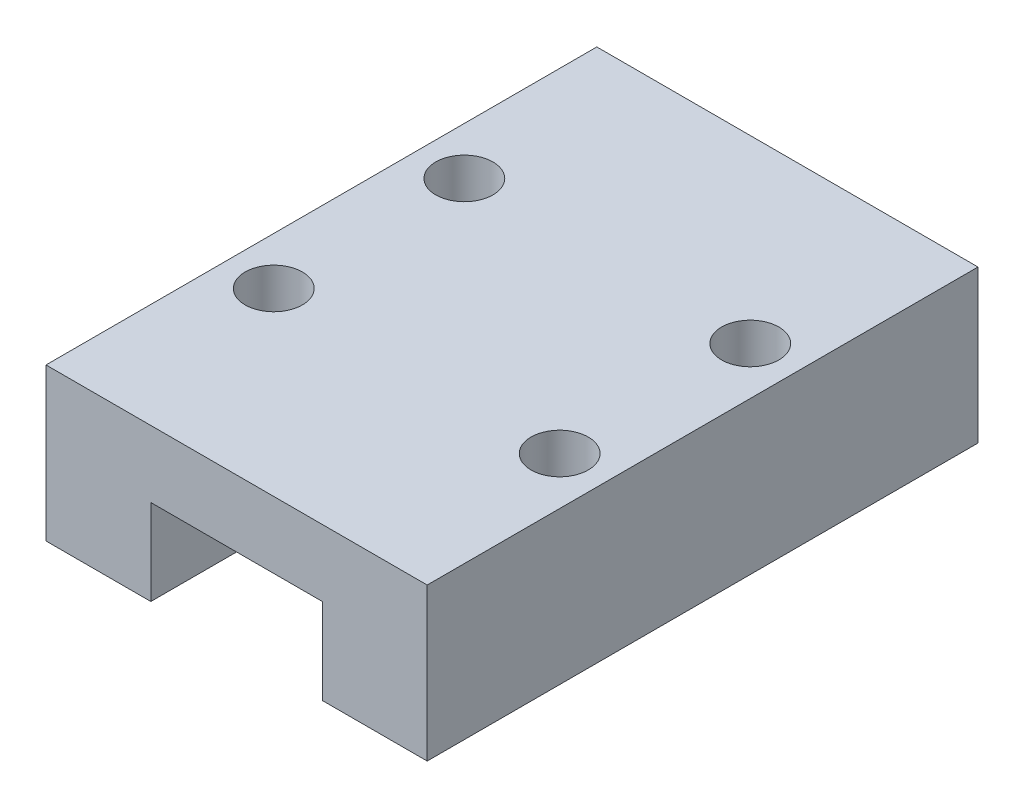
from build123d import *

# Parameters (mm, degrees)
EXTRUDE_1_DEPTH     = 28.9
SKETCH_3_R          = 1.5
CUT_EXTRUDE_1_DEPTH = 3


with BuildPart() as part:
    # 草图2 → 凸台-拉伸1 (new body)
    with BuildSketch(Plane.XY):
        Polygon((4.5, -4), (10, -4), (10, 4), (-10, 4), (-10, -4), (-4.5, -4), (-4.5, 0.5), (4.5, 0.5), align=None)
    extrude(amount=EXTRUDE_1_DEPTH)

    # 草图3 → 切除-拉伸1 (cut)
    with BuildSketch(Plane(origin=(0, 4, 0), x_dir=(1, 0, 0), z_dir=(0, 1, 0))):
        with Locations(Location((-7.5, -9.45, 0), (0, 0, 180))):
            Circle(SKETCH_3_R)
        with Locations(Location((7.5, -9.45, 0), (0, 0, 180))):
            Circle(SKETCH_3_R)
        with Locations(Location((7.5, -19.45, 0), (0, 0, 180))):
            Circle(SKETCH_3_R)
        with Locations(Location((-7.5, -19.45, 0), (0, 0, 180))):
            Circle(SKETCH_3_R)
    extrude(amount=-CUT_EXTRUDE_1_DEPTH, mode=Mode.SUBTRACT)


solid = part.part
